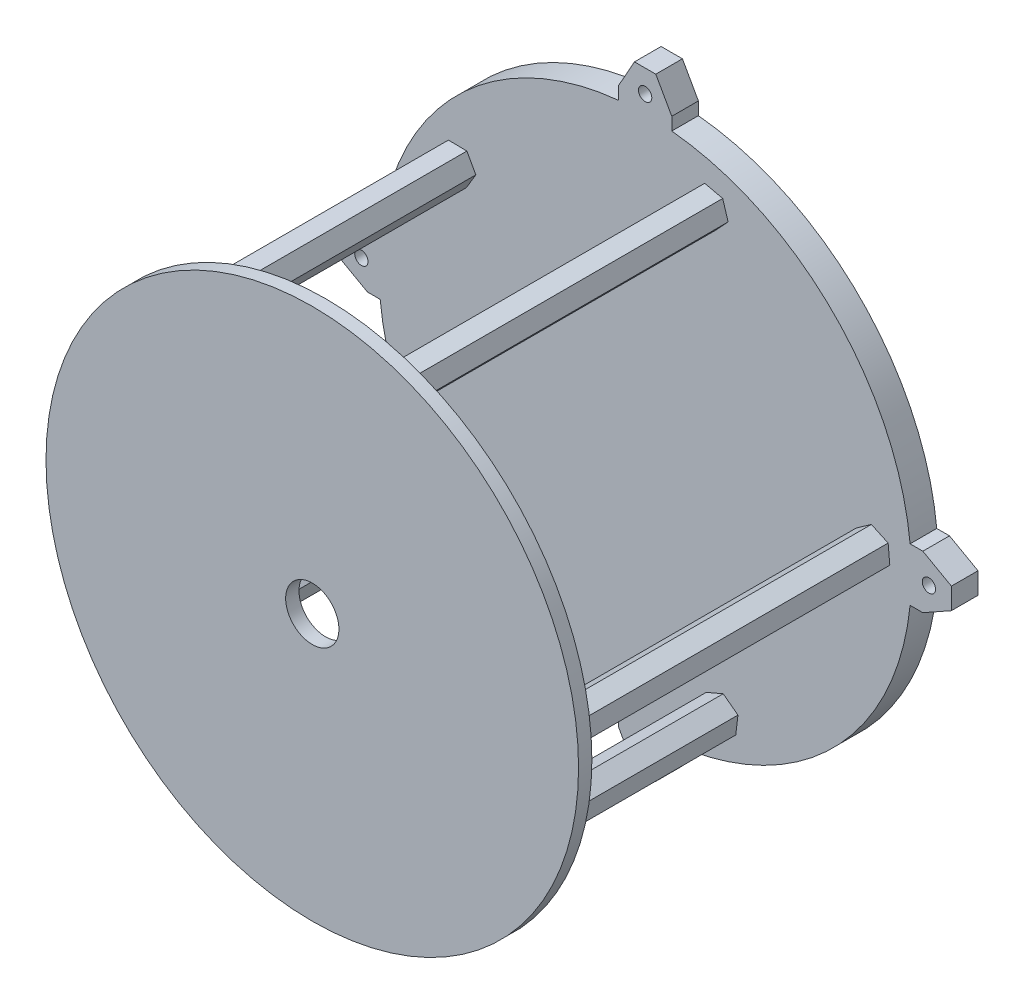
from build123d import *

# Parameters (mm, degrees)
SKETCH1_R           = 2.5
BOSS_EXTRUDE1_DEPTH = 10
BOSS_EXTRUDE2_DEPTH = 120
SKETCH3_R           = 100
SKETCH3_R_2         = 10
BOSS_EXTRUDE3_DEPTH = 5


with BuildPart() as part:
    # Sketch1 → Boss-Extrude1 (new body)
    with BuildSketch(Plane.XY):
        with BuildLine():
            Line((10, 99.498743711), (10, 104.292304576))
            Line((10, 104.292304576), (4, 115))
            Line((4, 115), (-4, 115))
            Line((-4, 115), (-10, 104.292304576))
            Line((-10, 104.292304576), (-10, 99.498743711))
            ThreePointArc((-10, 99.498743711), (-70.710678119, 70.710678119), (-99.498743711, 10))
            Line((-99.498743711, 10), (-104.292304576, 10))
            Line((-104.292304576, 10), (-115, 4))
            Line((-115, 4), (-115, -4))
            Line((-115, -4), (-104.292304576, -10))
            Line((-104.292304576, -10), (-99.498743711, -10))
            ThreePointArc((-99.498743711, -10), (-70.710678119, -70.710678119), (-10, -99.498743711))
            Line((-10, -99.498743711), (-10, -104.292304576))
            Line((-10, -104.292304576), (-4, -115))
            Line((-4, -115), (4, -115))
            Line((4, -115), (10, -104.292304576))
            Line((10, -104.292304576), (10, -99.498743711))
            ThreePointArc((10, -99.498743711), (70.710678119, -70.710678119), (99.498743711, -10))
            Line((99.498743711, -10), (104.292304576, -10))
            Line((104.292304576, -10), (115, -4))
            Line((115, -4), (115, 4))
            Line((115, 4), (104.292304576, 10))
            Line((104.292304576, 10), (99.498743711, 10))
            ThreePointArc((99.498743711, 10), (70.710678119, 70.710678119), (10, 99.498743711))
        make_face()
        with Locations((-106.562672681, 0)):
            Circle(SKETCH1_R, mode=Mode.SUBTRACT)
        with Locations((106.562672681, 0)):
            Circle(SKETCH1_R, mode=Mode.SUBTRACT)
        with Locations((0, 106.562672681)):
            Circle(SKETCH1_R, mode=Mode.SUBTRACT)
        with Locations((0, -106.562672681)):
            Circle(SKETCH1_R, mode=Mode.SUBTRACT)
    extrude(amount=BOSS_EXTRUDE1_DEPTH)

    # Sketch2 → Boss-Extrude2 (add)
    with BuildSketch(Plane.XY.offset(10)):
        Polygon((-61.183161588, -50.705696973), (-65.740333213, -45.487250194), (-72.538226504, -46.824653202), (-74.77894817, -53.380502987), (-70.221776545, -58.598949766), (-63.423883254, -57.261546759), align=None)
        Polygon((34.031190696, -84.892949499), (34.859909403, -78.01448853), (29.317346819, -73.857566592), (22.946065527, -76.579105623), (22.117346819, -83.457566592), (27.659909403, -87.61448853), align=None)
        Polygon((-67.13062022, 42.519722439), (-63.575825884, 48.466438948), (-66.948436282, 54.518339402), (-73.875841015, 54.623523347), (-77.430635351, 48.676806839), (-74.058024953, 42.624906385), align=None)
        Polygon((19.694156606, 76.984330633), (26.448311953, 75.441156778), (31.161817388, 80.518839962), (29.121167475, 87.139697001), (22.367012128, 88.682870856), (17.653506693, 83.605187672), align=None)
        Polygon((79.302278382, 5.059210493), (79.921781616, -1.841239909), (86.207498579, -4.75495957), (91.873712307, -0.768228831), (91.254209072, 6.13222157), (84.96849211, 9.045941232), align=None)
    extrude(amount=BOSS_EXTRUDE2_DEPTH)

    # Sketch3 → Boss-Extrude3 (add)
    with BuildSketch(Plane.XY.offset(130)):
        Circle(SKETCH3_R)
        Circle(SKETCH3_R_2, mode=Mode.SUBTRACT)
    extrude(amount=BOSS_EXTRUDE3_DEPTH)


solid = part.part
